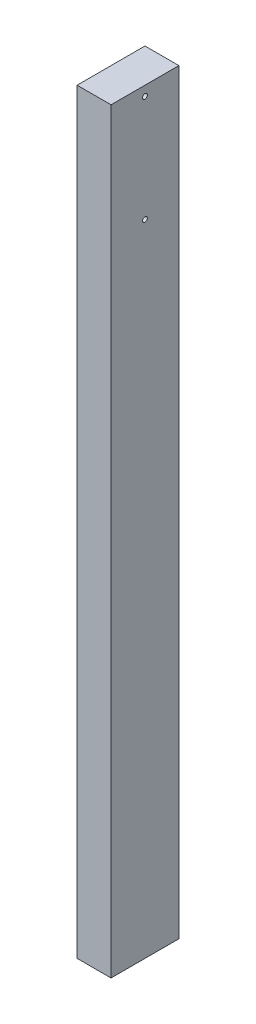
from build123d import *

# Parameters (mm, degrees)
SKETCH1_W           = 44.45
SKETCH1_H           = 88.9
BOSS_EXTRUDE1_DEPTH = 990.6
SKETCH2_R           = 3.175
CUT_EXTRUDE1_DEPTH  = 977.9


with BuildPart() as part:
    # Sketch1 → Boss-Extrude1 (new body)
    with BuildSketch(Plane(origin=(0, 0, 0), x_dir=(1, 0, 0), z_dir=(0, 1, 0))):
        Rectangle(SKETCH1_W, SKETCH1_H)
    extrude(amount=BOSS_EXTRUDE1_DEPTH)

    # Sketch2 → Cut-Extrude1 (cut)
    with BuildSketch(Plane.ZY.offset(22.225)):
        with Locations((0, 977.9)):
            Circle(SKETCH2_R)
        with Locations((0, 838.2)):
            Circle(SKETCH2_R)
    extrude(amount=-CUT_EXTRUDE1_DEPTH, mode=Mode.SUBTRACT)


solid = part.part
